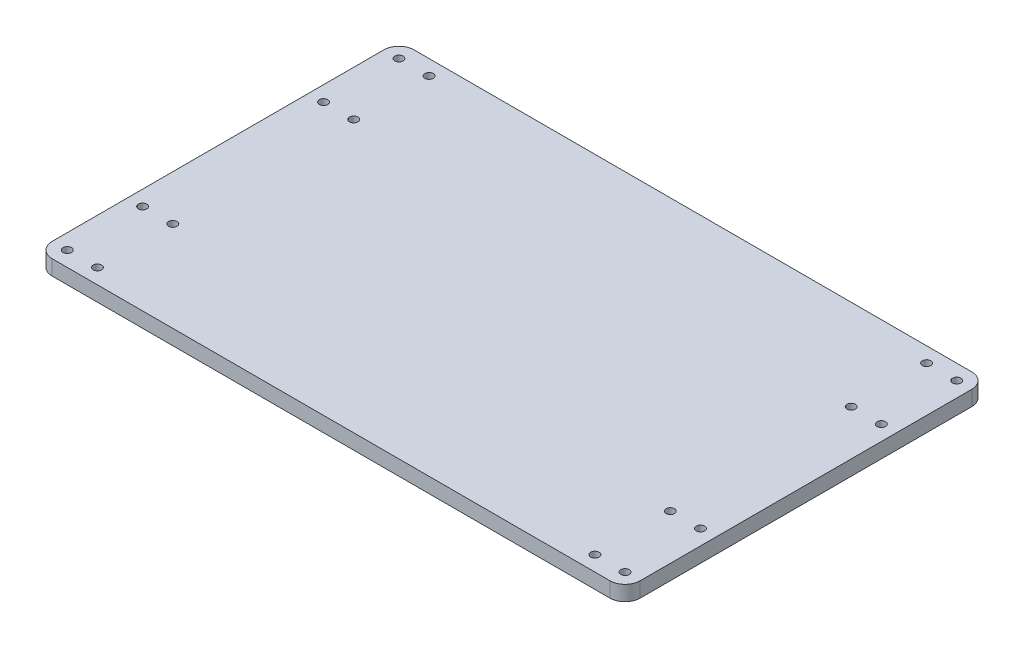
from build123d import *

# Parameters (mm, degrees)
SKETCH1_W            = 247.65
SKETCH1_H            = 152.4
BOSS_EXTRUDE1_DEPTH  = 6.35
FILLET1_R            = 6.35
SKETCH2_R            = 1.778
CUT_EXTRUDE1_DEPTH   = 146.531416282
LPATTERN1_COUNT      = 2
LPATTERN1_PITCH      = 222.25
LPATTERN1_COUNT_DIR2 = 2
LPATTERN1_PITCH_DIR2 = 107.95


with BuildPart() as part:
    # Sketch1 → Boss-Extrude1 (new body)
    with BuildSketch(Plane(origin=(0, 0, 0), x_dir=(1, 0, 0), z_dir=(0, 1, 0))):
        Rectangle(SKETCH1_W, SKETCH1_H)
    extrude(amount=BOSS_EXTRUDE1_DEPTH)

    # Fillet1
    fillet1_edges = [part.edges().sort_by_distance(p)[0] for p in [
        (123.825, 3.175, 76.2),
        (-123.825, 3.175, 76.2),
        (-123.825, 3.175, -76.2),
        (123.825, 3.175, -76.2),
    ]]
    fillet(fillet1_edges, radius=FILLET1_R)

    # Sketch2 → Cut-Extrude1 (cut, through all)
    with BuildSketch(Plane(origin=(0, 6.35, 0), x_dir=(1, 0, 0), z_dir=(0, 1, 0))):
        with Locations(Location((117.475, -69.85, 0), (0, 0, 270))):
            Circle(SKETCH2_R)
        with Locations(Location((104.775, -69.85, 0), (0, 0, 270))):
            Circle(SKETCH2_R)
        with Locations(Location((117.475, -38.1, 0), (0, 0, 270))):
            Circle(SKETCH2_R)
        with Locations(Location((104.775, -38.1, 0), (0, 0, 270))):
            Circle(SKETCH2_R)
    cut_extrude1 = extrude(amount=-CUT_EXTRUDE1_DEPTH, mode=Mode.SUBTRACT)

    # LPattern1: Cut-Extrude1 2 × 2
    with Locations(*[(-i * LPATTERN1_PITCH, 0, -j * LPATTERN1_PITCH_DIR2) for i in range(LPATTERN1_COUNT) for j in range(LPATTERN1_COUNT_DIR2) if (i, j) != (0, 0)]):
        add(cut_extrude1, mode=Mode.SUBTRACT)


solid = part.part
